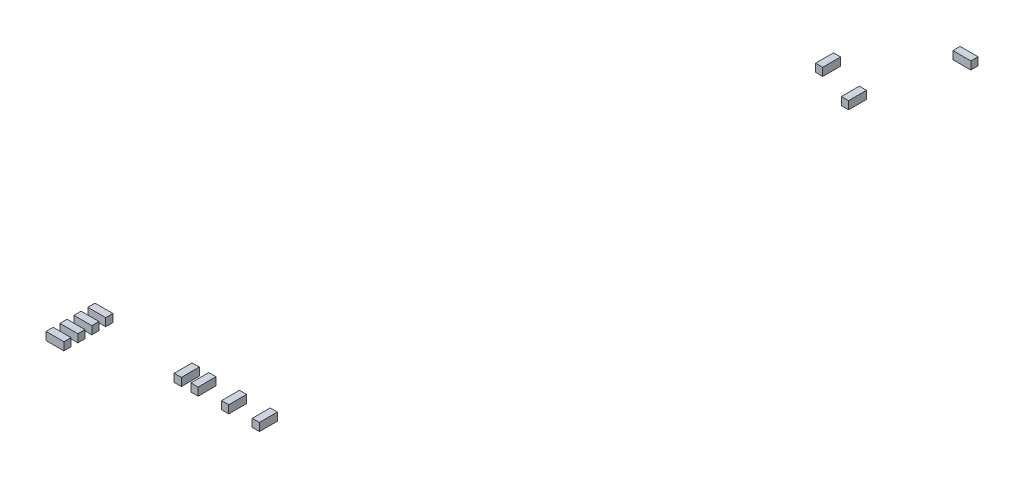
from build123d import *

# Parameters (mm, degrees)
SKETCH1_W              = 1.143
SKETCH1_H              = 0.4572
BOSS_EXTRUDE1_DEPTH    = 0.508
BOSS_EXTRUDE1_2_DEPTH  = 0.508
BOSS_EXTRUDE1_3_DEPTH  = 0.508
BOSS_EXTRUDE1_4_DEPTH  = 0.508
SKETCH1_W_2            = 0.4572
SKETCH1_H_2            = 1.143
BOSS_EXTRUDE1_5_DEPTH  = 0.508
BOSS_EXTRUDE1_6_DEPTH  = 0.508
BOSS_EXTRUDE1_7_DEPTH  = 0.508
BOSS_EXTRUDE1_8_DEPTH  = 0.508
BOSS_EXTRUDE1_9_DEPTH  = 0.508
BOSS_EXTRUDE1_10_DEPTH = 0.508
BOSS_EXTRUDE1_11_DEPTH = 0.508


with BuildPart() as part:
    # Sketch1 → Boss-Extrude1 (new body)
    with BuildSketch(Plane(origin=(0, 0, 0), x_dir=(1, 0, 0), z_dir=(0, 1, 0))):
        with Locations((0.5715, 0.2286)):
            Rectangle(SKETCH1_W, SKETCH1_H)
    extrude(amount=BOSS_EXTRUDE1_DEPTH)


with BuildPart() as body_2:
    # Sketch1 → Boss-Extrude1 2 (new body)
    with BuildSketch(Plane(origin=(0, 0, 0), x_dir=(1, 0, 0), z_dir=(0, 1, 0))):
        with Locations((0.5715, 1.1176)):
            Rectangle(SKETCH1_W, SKETCH1_H)
    extrude(amount=BOSS_EXTRUDE1_2_DEPTH)


with BuildPart() as body_3:
    # Sketch1 → Boss-Extrude1 3 (new body)
    with BuildSketch(Plane(origin=(0, 0, 0), x_dir=(1, 0, 0), z_dir=(0, 1, 0))):
        with Locations((0.5715, 2.0066)):
            Rectangle(SKETCH1_W, SKETCH1_H)
    extrude(amount=BOSS_EXTRUDE1_3_DEPTH)


with BuildPart() as body_4:
    # Sketch1 → Boss-Extrude1 4 (new body)
    with BuildSketch(Plane(origin=(0, 0, 0), x_dir=(1, 0, 0), z_dir=(0, 1, 0))):
        with Locations((0.5715, 2.8956)):
            Rectangle(SKETCH1_W, SKETCH1_H)
    extrude(amount=BOSS_EXTRUDE1_4_DEPTH)


with BuildPart() as body_5:
    # Sketch1 → Boss-Extrude1 5 (new body)
    with BuildSketch(Plane(origin=(0, 0, 0), x_dir=(1, 0, 0), z_dir=(0, 1, 0))):
        with Locations((6.6294, 2.3495)):
            Rectangle(SKETCH1_W_2, SKETCH1_H_2)
    extrude(amount=BOSS_EXTRUDE1_5_DEPTH)


with BuildPart() as body_6:
    # Sketch1 → Boss-Extrude1 6 (new body)
    with BuildSketch(Plane(origin=(0, 0, 0), x_dir=(1, 0, 0), z_dir=(0, 1, 0))):
        with Locations((7.6962, 2.3495)):
            Rectangle(SKETCH1_W_2, SKETCH1_H_2)
    extrude(amount=BOSS_EXTRUDE1_6_DEPTH)


with BuildPart() as body_7:
    # Sketch1 → Boss-Extrude1 7 (new body)
    with BuildSketch(Plane(origin=(0, 0, 0), x_dir=(1, 0, 0), z_dir=(0, 1, 0))):
        with Locations((9.652, 2.3495)):
            Rectangle(SKETCH1_W_2, SKETCH1_H_2)
    extrude(amount=BOSS_EXTRUDE1_7_DEPTH)


with BuildPart() as body_8:
    # Sketch1 → Boss-Extrude1 8 (new body)
    with BuildSketch(Plane(origin=(0, 0, 0), x_dir=(1, 0, 0), z_dir=(0, 1, 0))):
        with Locations((11.6078, 2.3495)):
            Rectangle(SKETCH1_W_2, SKETCH1_H_2)
    extrude(amount=BOSS_EXTRUDE1_8_DEPTH)


with BuildPart() as body_9:
    # Sketch1 → Boss-Extrude1 9 (new body)
    with BuildSketch(Plane(origin=(0, 0, 0), x_dir=(1, 0, 0), z_dir=(0, 1, 0))):
        with Locations((9.9568, 39.9415)):
            Rectangle(SKETCH1_W_2, SKETCH1_H_2)
    extrude(amount=BOSS_EXTRUDE1_9_DEPTH)


with BuildPart() as body_10:
    # Sketch1 → Boss-Extrude1 10 (new body)
    with BuildSketch(Plane(origin=(0, 0, 0), x_dir=(1, 0, 0), z_dir=(0, 1, 0))):
        with Locations((12.6238, 38.9255)):
            Rectangle(SKETCH1_W_2, SKETCH1_H_2)
    extrude(amount=BOSS_EXTRUDE1_10_DEPTH)


with BuildPart() as body_11:
    # Sketch1 → Boss-Extrude1 11 (new body)
    with BuildSketch(Plane(origin=(0, 0, 0), x_dir=(1, 0, 0), z_dir=(0, 1, 0))):
        with Locations((13.9827, 44.6786)):
            Rectangle(SKETCH1_W, SKETCH1_H)
    extrude(amount=BOSS_EXTRUDE1_11_DEPTH)


solid = Compound([part.part, body_2.part, body_3.part, body_4.part, body_5.part, body_6.part, body_7.part, body_8.part, body_9.part, body_10.part, body_11.part])
